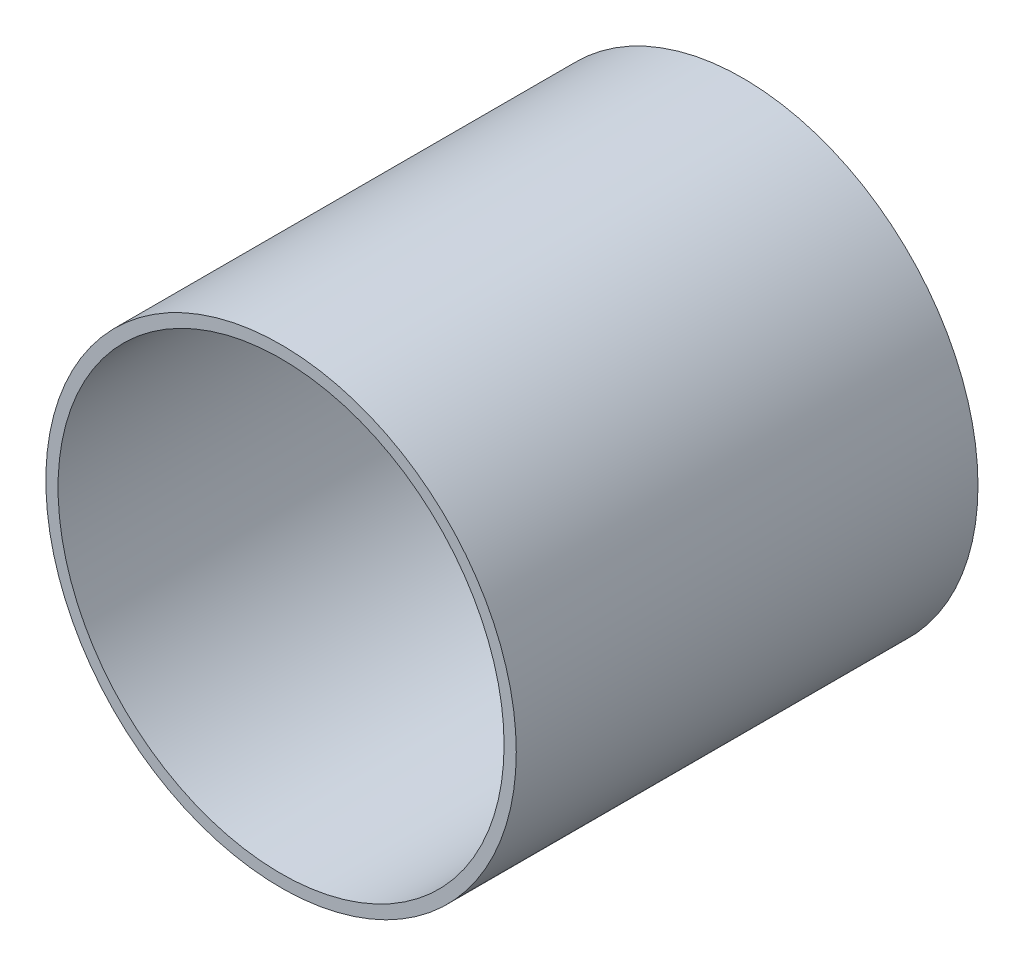
from build123d import *

# Parameters (mm, degrees)
SKETCH1_R           = 27
BOSS_EXTRUDE1_DEPTH = 53
SHELL3_T            = -1.4


with BuildPart() as part:
    # Sketch1 → Boss-Extrude1 (new body)
    with BuildSketch(Plane.XY):
        Circle(SKETCH1_R)
    extrude(amount=BOSS_EXTRUDE1_DEPTH)

    # Shell3
    shell3_openings = [part.faces().sort_by_distance(p)[0] for p in [
        (0, 0, 53),
    ]]
    offset(amount=SHELL3_T, openings=shell3_openings, kind=Kind.INTERSECTION)


solid = part.part
